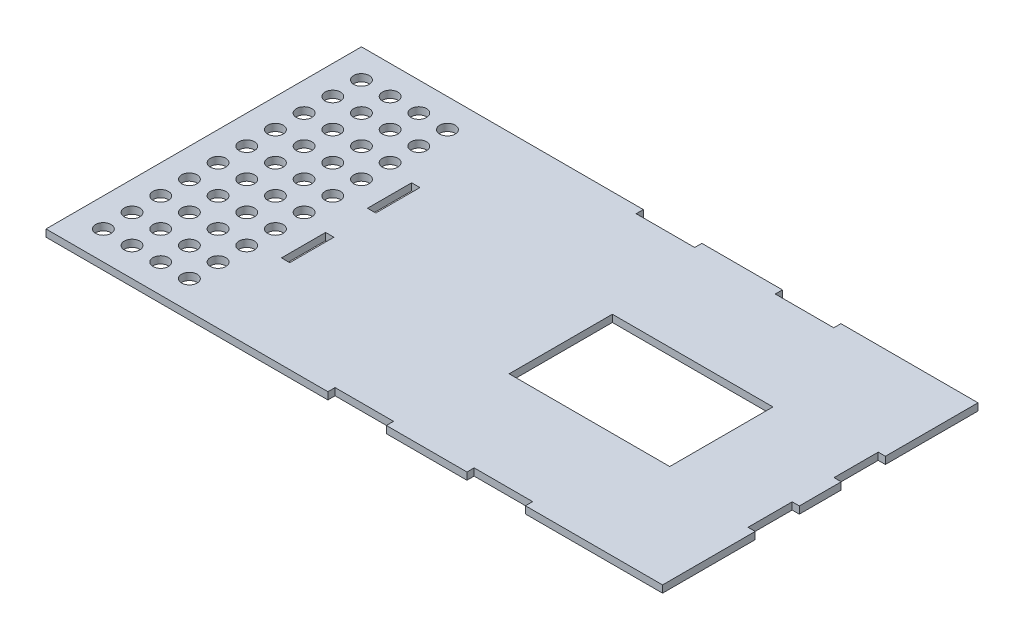
from build123d import *

# Parameters (mm, degrees)
SKETCH1_W           = 203.2
SKETCH1_H           = 133.35
BOSS_EXTRUDE1_DEPTH = 3.175
SKETCH3_W           = 35.687
SKETCH3_H           = 3.175
BOSS_EXTRUDE2_DEPTH = 3.175
SKETCH4_W           = 3.175
SKETCH4_H           = 18.542
BOSS_EXTRUDE3_DEPTH = 3.175
SKETCH5_W           = 63.5
SKETCH5_H           = 139.7
SKETCH5_R           = 3.429
BOSS_EXTRUDE4_DEPTH = 3.175
BOSS_EXTRUDE5_DEPTH = 3.175
SKETCH7_W           = 3.683
SKETCH7_H           = 19.558
CUT_EXTRUDE1_DEPTH  = 183.223979624
SKETCH8_W           = 71.12
SKETCH8_H           = 45.72
CUT_EXTRUDE4_DEPTH  = 183.223979624


with BuildPart() as part:
    # Sketch1 → Boss-Extrude1 (new body)
    with BuildSketch(Plane(origin=(0, 0, 0), x_dir=(1, 0, 0), z_dir=(0, 1, 0))):
        Rectangle(SKETCH1_W, SKETCH1_H)
    extrude(amount=BOSS_EXTRUDE1_DEPTH)

    # Sketch3 → Boss-Extrude2 (add)
    with BuildSketch(Plane(origin=(0, 3.175, 0), x_dir=(1, 0, 0), z_dir=(0, 1, 0))):
        with Locations((-61.2775, 68.2625)):
            Rectangle(SKETCH3_W, SKETCH3_H)
        with Locations((0.3175, 68.2625)):
            Rectangle(SKETCH3_W, SKETCH3_H)
        with Locations((61.9125, 68.2625)):
            Rectangle(SKETCH3_W, SKETCH3_H)
        with Locations((61.9125, -68.2625)):
            Rectangle(SKETCH3_W, SKETCH3_H)
        with Locations((0.3175, -68.2625)):
            Rectangle(SKETCH3_W, SKETCH3_H)
        with Locations((-61.2775, -68.2625)):
            Rectangle(SKETCH3_W, SKETCH3_H)
    extrude(amount=-BOSS_EXTRUDE2_DEPTH)

    # Sketch4 → Boss-Extrude3 (add)
    with BuildSketch(Plane(origin=(0, 3.175, 0), x_dir=(1, 0, 0), z_dir=(0, 1, 0))):
        with Locations((-103.1875, 38.1)):
            Rectangle(SKETCH4_W, SKETCH4_H)
        with Locations((-103.1875, 0)):
            Rectangle(SKETCH4_W, SKETCH4_H)
        with Locations((-103.1875, -38.1)):
            Rectangle(SKETCH4_W, SKETCH4_H)
        with Locations((103.1875, -38.1)):
            Rectangle(SKETCH4_W, SKETCH4_H)
        with Locations((103.1875, 0)):
            Rectangle(SKETCH4_W, SKETCH4_H)
        with Locations((103.1875, 38.1)):
            Rectangle(SKETCH4_W, SKETCH4_H)
    extrude(amount=-BOSS_EXTRUDE3_DEPTH)

    # Sketch5 → Boss-Extrude4 (add)
    with BuildSketch(Plane(origin=(0, 3.175, 0), x_dir=(1, 0, 0), z_dir=(0, 1, 0))):
        with Locations((-136.525, 0)):
            Rectangle(SKETCH5_W, SKETCH5_H)
        with Locations(Location((-117.475, 57.15, 0), (0, 0, 270))):
            Circle(SKETCH5_R, mode=Mode.SUBTRACT)
        with Locations(Location((-130.175, 57.15, 0), (0, 0, 270))):
            Circle(SKETCH5_R, mode=Mode.SUBTRACT)
        with Locations(Location((-142.875, 57.15, 0), (0, 0, 270))):
            Circle(SKETCH5_R, mode=Mode.SUBTRACT)
        with Locations(Location((-155.575, 57.15, 0), (0, 0, 270))):
            Circle(SKETCH5_R, mode=Mode.SUBTRACT)
        with Locations(Location((-130.175, 44.45, 0), (0, 0, 270))):
            Circle(SKETCH5_R, mode=Mode.SUBTRACT)
        with Locations(Location((-142.875, 44.45, 0), (0, 0, 270))):
            Circle(SKETCH5_R, mode=Mode.SUBTRACT)
        with Locations(Location((-155.575, 44.45, 0), (0, 0, 270))):
            Circle(SKETCH5_R, mode=Mode.SUBTRACT)
        with Locations(Location((-130.175, 31.75, 0), (0, 0, 270))):
            Circle(SKETCH5_R, mode=Mode.SUBTRACT)
        with Locations(Location((-142.875, 31.75, 0), (0, 0, 270))):
            Circle(SKETCH5_R, mode=Mode.SUBTRACT)
        with Locations(Location((-155.575, 31.75, 0), (0, 0, 270))):
            Circle(SKETCH5_R, mode=Mode.SUBTRACT)
        with Locations(Location((-130.175, 19.05, 0), (0, 0, 270))):
            Circle(SKETCH5_R, mode=Mode.SUBTRACT)
        with Locations(Location((-142.875, 19.05, 0), (0, 0, 270))):
            Circle(SKETCH5_R, mode=Mode.SUBTRACT)
        with Locations(Location((-155.575, 19.05, 0), (0, 0, 270))):
            Circle(SKETCH5_R, mode=Mode.SUBTRACT)
        with Locations(Location((-130.175, 6.35, 0), (0, 0, 270))):
            Circle(SKETCH5_R, mode=Mode.SUBTRACT)
        with Locations(Location((-142.875, 6.35, 0), (0, 0, 270))):
            Circle(SKETCH5_R, mode=Mode.SUBTRACT)
        with Locations(Location((-155.575, 6.35, 0), (0, 0, 270))):
            Circle(SKETCH5_R, mode=Mode.SUBTRACT)
        with Locations(Location((-130.175, -6.35, 0), (0, 0, 270))):
            Circle(SKETCH5_R, mode=Mode.SUBTRACT)
        with Locations(Location((-142.875, -6.35, 0), (0, 0, 270))):
            Circle(SKETCH5_R, mode=Mode.SUBTRACT)
        with Locations(Location((-155.575, -6.35, 0), (0, 0, 270))):
            Circle(SKETCH5_R, mode=Mode.SUBTRACT)
        with Locations(Location((-130.175, -19.05, 0), (0, 0, 270))):
            Circle(SKETCH5_R, mode=Mode.SUBTRACT)
        with Locations(Location((-142.875, -19.05, 0), (0, 0, 270))):
            Circle(SKETCH5_R, mode=Mode.SUBTRACT)
        with Locations(Location((-155.575, -19.05, 0), (0, 0, 270))):
            Circle(SKETCH5_R, mode=Mode.SUBTRACT)
        with Locations(Location((-130.175, -31.75, 0), (0, 0, 270))):
            Circle(SKETCH5_R, mode=Mode.SUBTRACT)
        with Locations(Location((-142.875, -31.75, 0), (0, 0, 270))):
            Circle(SKETCH5_R, mode=Mode.SUBTRACT)
        with Locations(Location((-155.575, -31.75, 0), (0, 0, 270))):
            Circle(SKETCH5_R, mode=Mode.SUBTRACT)
        with Locations(Location((-130.175, -44.45, 0), (0, 0, 270))):
            Circle(SKETCH5_R, mode=Mode.SUBTRACT)
        with Locations(Location((-142.875, -44.45, 0), (0, 0, 270))):
            Circle(SKETCH5_R, mode=Mode.SUBTRACT)
        with Locations(Location((-155.575, -44.45, 0), (0, 0, 270))):
            Circle(SKETCH5_R, mode=Mode.SUBTRACT)
        with Locations(Location((-130.175, -57.15, 0), (0, 0, 270))):
            Circle(SKETCH5_R, mode=Mode.SUBTRACT)
        with Locations(Location((-142.875, -57.15, 0), (0, 0, 270))):
            Circle(SKETCH5_R, mode=Mode.SUBTRACT)
        with Locations(Location((-155.575, -57.15, 0), (0, 0, 270))):
            Circle(SKETCH5_R, mode=Mode.SUBTRACT)
        with Locations(Location((-117.475, 44.45, 0), (0, 0, 270))):
            Circle(SKETCH5_R, mode=Mode.SUBTRACT)
        with Locations(Location((-117.475, 31.75, 0), (0, 0, 270))):
            Circle(SKETCH5_R, mode=Mode.SUBTRACT)
        with Locations(Location((-117.475, 19.05, 0), (0, 0, 270))):
            Circle(SKETCH5_R, mode=Mode.SUBTRACT)
        with Locations(Location((-117.475, 6.35, 0), (0, 0, 270))):
            Circle(SKETCH5_R, mode=Mode.SUBTRACT)
        with Locations(Location((-117.475, -6.35, 0), (0, 0, 270))):
            Circle(SKETCH5_R, mode=Mode.SUBTRACT)
        with Locations(Location((-117.475, -19.05, 0), (0, 0, 270))):
            Circle(SKETCH5_R, mode=Mode.SUBTRACT)
        with Locations(Location((-117.475, -31.75, 0), (0, 0, 270))):
            Circle(SKETCH5_R, mode=Mode.SUBTRACT)
        with Locations(Location((-117.475, -44.45, 0), (0, 0, 270))):
            Circle(SKETCH5_R, mode=Mode.SUBTRACT)
        with Locations(Location((-117.475, -57.15, 0), (0, 0, 270))):
            Circle(SKETCH5_R, mode=Mode.SUBTRACT)
    extrude(amount=-BOSS_EXTRUDE4_DEPTH)

    # Sketch6 → Boss-Extrude5 (add)
    with BuildSketch(Plane(origin=(0, 3.175, 0), x_dir=(1, 0, 0), z_dir=(0, 1, 0))):
        Polygon((-79.121, 66.675), (-79.121, 69.85), (-104.775, 69.85), (-104.775, 58.6105), (-104.775, 47.371), (-101.6, 47.371), (-101.6, 66.675), align=None)
        Polygon((-104.775, -47.371), (-104.775, -58.6105), (-104.775, -69.85), (-79.121, -69.85), (-79.121, -66.675), (-101.6, -66.675), (-101.6, -47.371), align=None)
        Polygon((79.121, -66.675), (79.121, -69.85), (104.775, -69.85), (104.775, -58.6105), (104.775, -47.371), (101.6, -47.371), (101.6, -66.675), align=None)
        Polygon((104.775, 47.371), (104.775, 58.6105), (104.775, 69.85), (79.121, 69.85), (79.121, 66.675), (101.6, 66.675), (101.6, 47.371), align=None)
    extrude(amount=-BOSS_EXTRUDE5_DEPTH)

    # Sketch7 → Cut-Extrude1 (cut, through all)
    with BuildSketch(Plane(origin=(0, 3.175, 0), x_dir=(1, 0, 0), z_dir=(0, 1, 0))):
        with Locations((-103.1875, 19.05)):
            Rectangle(SKETCH7_W, SKETCH7_H)
        with Locations((-103.1875, -19.05)):
            Rectangle(SKETCH7_W, SKETCH7_H)
    extrude(amount=-CUT_EXTRUDE1_DEPTH, mode=Mode.SUBTRACT)

    # Sketch8 → Cut-Extrude4 (cut, through all)
    with BuildSketch(Plane(origin=(0, 0, 0), x_dir=(1, 0, 0), z_dir=(0, 1, 0))):
        with Locations((25.4, 0)):
            Rectangle(SKETCH8_W, SKETCH8_H)
    extrude(amount=CUT_EXTRUDE4_DEPTH, mode=Mode.SUBTRACT)


solid = part.part
